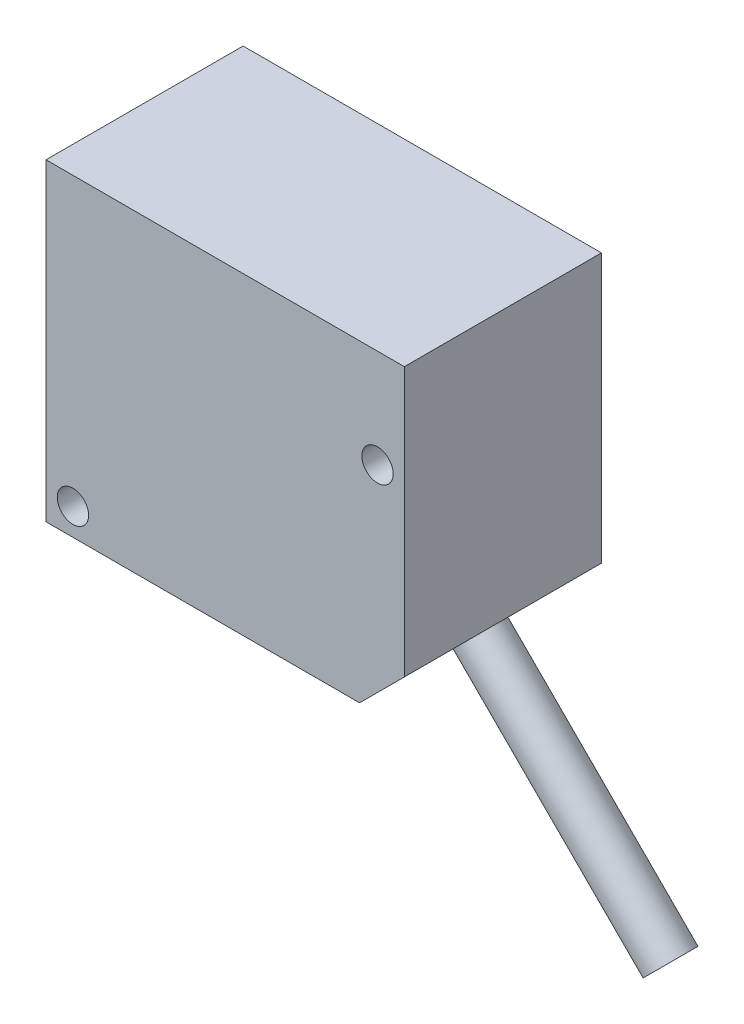
from build123d import *

# Parameters (mm, degrees)
SKETCH_1_W          = 40
SKETCH_1_H          = 35
EXTRUDE_1_DEPTH     = 22
SKETCH_2_R          = 1.75
CUT_EXTRUDE_1_DEPTH = 35.5
CHAMFER_1_SIZE      = 5
SKETCH_3_R          = 2.5
EXTRUDE_2_DEPTH     = 30
SKETCH_4_W          = 14.42354322
SKETCH_4_H          = 26.54144869
CUT_EXTRUDE_2_DEPTH = 0.1


with BuildPart() as part:
    # 草图1 → 凸台-拉伸1 (new body)
    with BuildSketch(Plane.XY):
        Rectangle(SKETCH_1_W, SKETCH_1_H)
    extrude(amount=EXTRUDE_1_DEPTH)

    # 草图2 → 切除-拉伸1 (cut, through all)
    with BuildSketch(Plane.XY.offset(22)):
        with Locations((17, 6.5)):
            Circle(SKETCH_2_R)
        with Locations((-17, -14.5)):
            Circle(SKETCH_2_R)
    extrude(amount=-CUT_EXTRUDE_1_DEPTH, mode=Mode.SUBTRACT)

    # 倒角1
    chamfer_1_edges = [part.edges().sort_by_distance(p)[0] for p in [
        (20, -17.5, 11),
    ]]
    chamfer(chamfer_1_edges, length=CHAMFER_1_SIZE)

    # 草图3 → 凸台-拉伸2 (add)
    with BuildSketch(Plane(origin=(16.25, -16.25, 0), x_dir=(0, 0, -1), z_dir=(0.7071067811865467, -0.7071067811865485, 0))):
        with Locations(Location((-11, 1.767766953, 0), (0, 0, 90))):
            Circle(SKETCH_3_R)
    extrude(amount=EXTRUDE_2_DEPTH)

    # 草图4 → 切除-拉伸2 (cut)
    with BuildSketch(Plane.ZY.offset(20)):
        with Locations((11, 0)):
            Rectangle(SKETCH_4_W, SKETCH_4_H)
    extrude(amount=-CUT_EXTRUDE_2_DEPTH, mode=Mode.SUBTRACT)


solid = part.part
